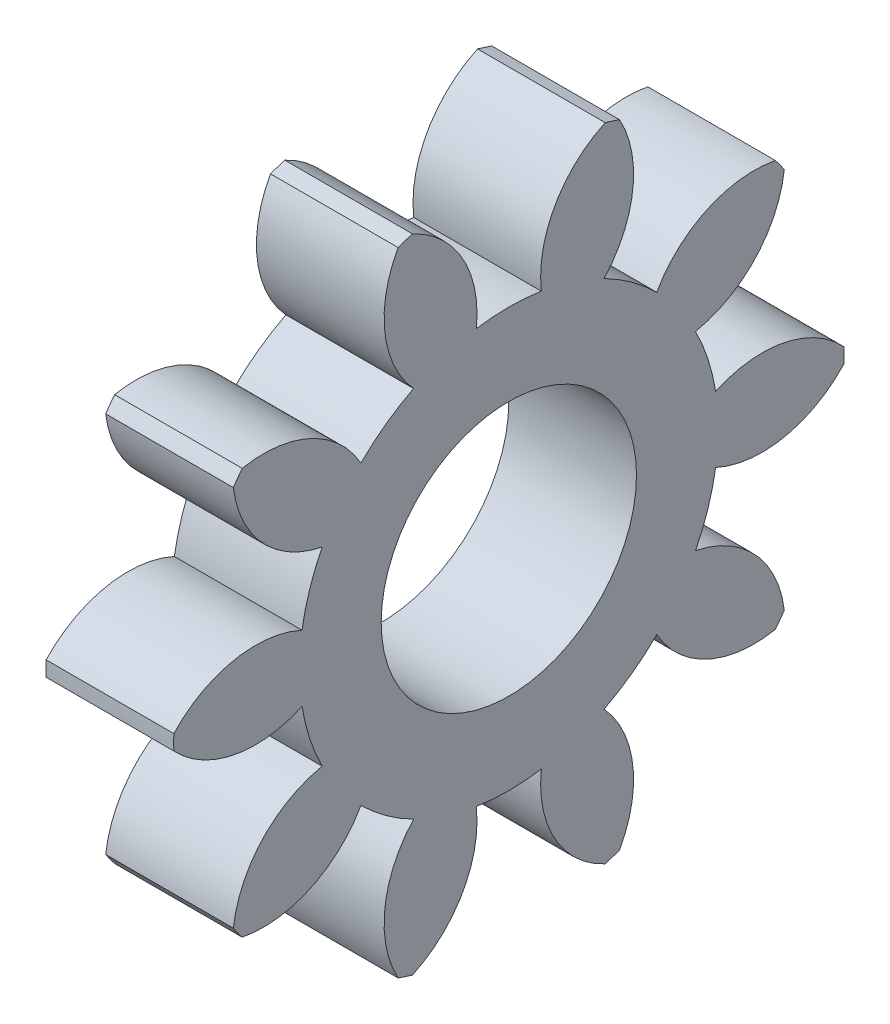
from build123d import *

# Parameters (mm, degrees)
BASPROSKE_W        = 4
BASPROSKE_H        = 10.5
TOOTHCUT_DEPTH     = 16.378556499
TEETHCUTS_COUNT    = 10
TEETHCUTS_ANGLE    = 324
BORSKE_R           = 0.5
BORE_DEPTH         = 50.0000508
SKETCH1_R          = 4
CUT_EXTRUDE1_DEPTH = 10


with BuildPart() as part:
    # BasProSke → Base-Revolve (revolve)
    with BuildSketch(Plane(origin=(0, 0, 0), x_dir=(1, 0, 0), z_dir=(0, 1, 0)), mode=Mode.PRIVATE) as base_revolve_sk:
        with Locations((2, 5.25)):
            Rectangle(BASPROSKE_W, BASPROSKE_H)
    revolve(base_revolve_sk.sketch.rotate(Axis((-10, 0, 0), (1, 0, 0)), 180), axis=Axis((-10, 0, 0), (1, 0, 0)))

    # TooCutSke → ToothCut (cut, through all)
    with BuildSketch(Plane(origin=(0, 0, 0), x_dir=(0, 0, -1), z_dir=(1, 0, 0))):
        with BuildLine():
            ThreePointArc((1.019600066, 6.481797432), (0, 6.5615), (-1.019600066, 6.481797432))
            ThreePointArc((-1.019600066, 6.481797432), (-1.451036104, 8.608938557), (-3.053606956, 10.072712133))
            ThreePointArc((-3.053606956, 10.072712133), (0, 10.5254), (3.053606956, 10.072712133))
            ThreePointArc((3.053606956, 10.072712133), (1.451036104, 8.608938557), (1.019600066, 6.481797432))
        make_face()
    toothcut = extrude(amount=TOOTHCUT_DEPTH, mode=Mode.SUBTRACT)

    # TeethCuts: ToothCut ×10 about axis
    teethcuts_axis = Axis((-10, 0, 0), (1, 0, 0))
    for i in range(1, TEETHCUTS_COUNT):
        add(toothcut.rotate(teethcuts_axis, i * TEETHCUTS_ANGLE / (TEETHCUTS_COUNT - 1)), mode=Mode.SUBTRACT)

    # BorSke → Bore (cut, symmetric)
    with BuildSketch(Plane(origin=(0, 0, 0), x_dir=(0, 0, -1), z_dir=(1, 0, 0))):
        with Locations(Location((0, 0, 0), (0, 0, 180))):
            Circle(BORSKE_R)
    extrude(amount=BORE_DEPTH, both=True, mode=Mode.SUBTRACT)

    # Sketch1 → Cut-Extrude1 (cut)
    with BuildSketch(Plane(origin=(4, 0, 0), x_dir=(0, 0, -1), z_dir=(1, 0, 0))):
        Circle(SKETCH1_R)
    extrude(amount=-CUT_EXTRUDE1_DEPTH, mode=Mode.SUBTRACT)


solid = part.part
